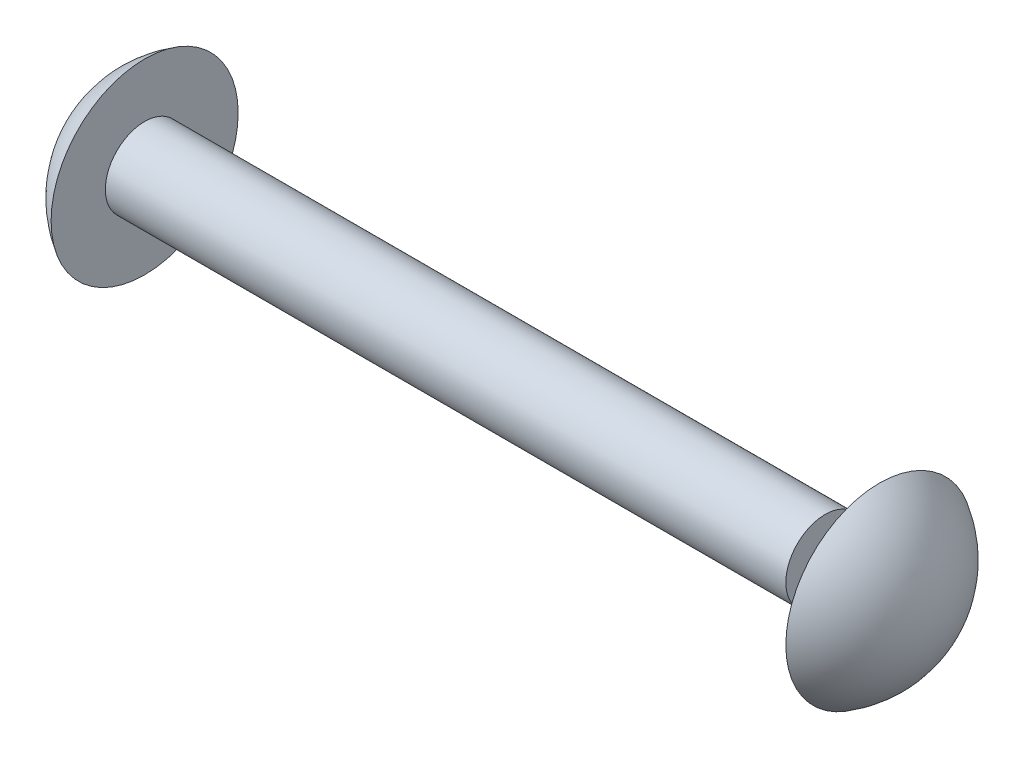
from build123d import *

# Parameters (mm, degrees)
SKETCH2_R           = 1.45
BOSS_EXTRUDE1_DEPTH = 12.55
CIRPATTERN3_COUNT   = 2


with BuildPart() as part:
    # Sketch2 → Boss-Extrude1 (new, symmetric)
    with BuildSketch(Plane.YZ):
        with Locations(Location((0, 0, 0), (0, 0, 270))):
            Circle(SKETCH2_R)
    extrude(amount=BOSS_EXTRUDE1_DEPTH, both=True)


with BuildPart() as body_2:
    # Sketch3 → Revolve1 (revolve)
    with BuildSketch(Plane(origin=(0, 0, 0), x_dir=(0, 1, 0), z_dir=(0, 0, 1))):
        with BuildLine():
            Line((0, 12.55), (0, 14.55))
            ThreePointArc((0, 14.55), (1.993896938, 14.013847218), (3.45, 12.55))
            Line((3.45, 12.55), (0, 12.55))
        make_face()
    revolve(axis=Axis((-12.55, 0, 0), (-1, 0, 0)))


with BuildPart() as cirpattern3_1:
    # CirPattern3: pattern copy
    add(body_2.part.rotate(Axis((1, 0, 0), (0, 0, 1)), 1 * 360 / CIRPATTERN3_COUNT))


solid = Compound([part.part, body_2.part, cirpattern3_1.part])
